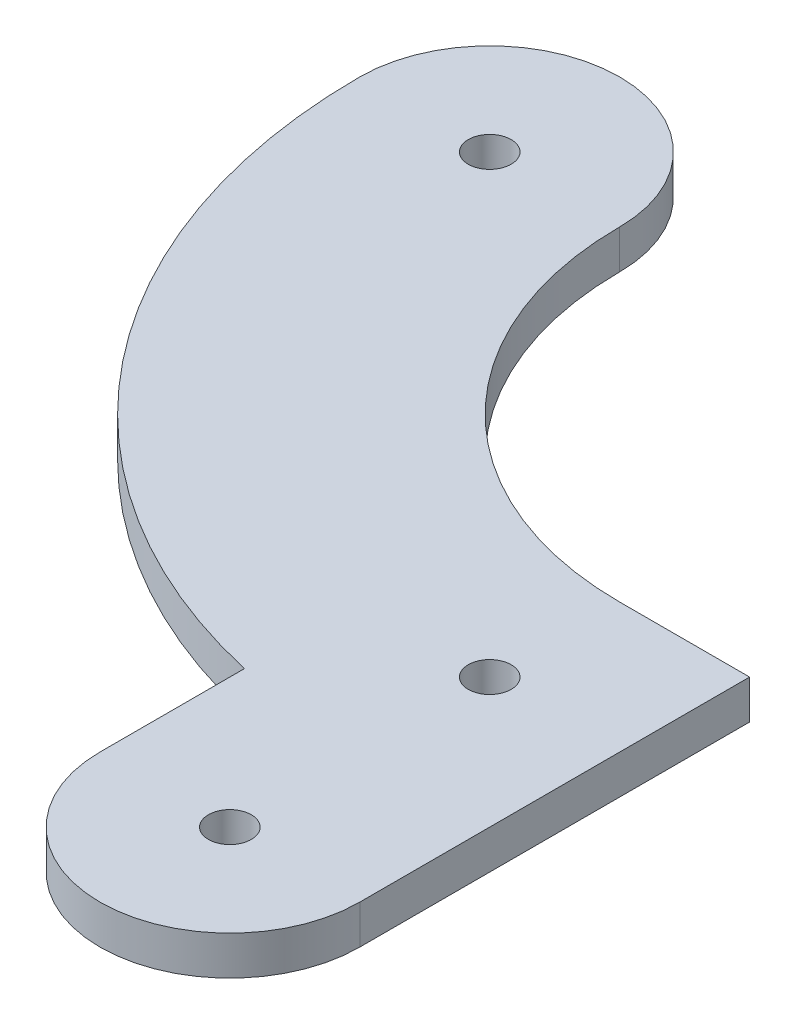
from build123d import *

# Parameters (mm, degrees)
SKETCH_1_R      = 1.65
EXTRUDE_1_DEPTH = 3


with BuildPart() as part:
    # 草图1 → 凸台-拉伸1 (new body)
    with BuildSketch(Plane(origin=(0, 0, 0), x_dir=(1, 0, 0), z_dir=(0, 1, 0))):
        with BuildLine():
            Line((10, 0), (10, 30))
            Line((10, 30), (0, 30))
            ThreePointArc((0, 30), (-17.67766953, 37.32233047), (-25, 55))
            ThreePointArc((-25, 55), (-35, 65), (-45, 55))
            ThreePointArc((-45, 55), (-35.178118199, 26.937569599), (-10, 11.125178063))
            Line((-10, 11.125178063), (-10, 0))
            ThreePointArc((-10, 0), (0, -10), (10, 0))
        make_face()
        with Locations(Location((-35, 55, 0), (0, 0, 270))):
            Circle(SKETCH_1_R, mode=Mode.SUBTRACT)
        with Locations(Location((0, 20, 0), (0, 0, 270))):
            Circle(SKETCH_1_R, mode=Mode.SUBTRACT)
        with Locations(Location((0, 0, 0), (0, 0, 270))):
            Circle(SKETCH_1_R, mode=Mode.SUBTRACT)
    extrude(amount=EXTRUDE_1_DEPTH)


solid = part.part
